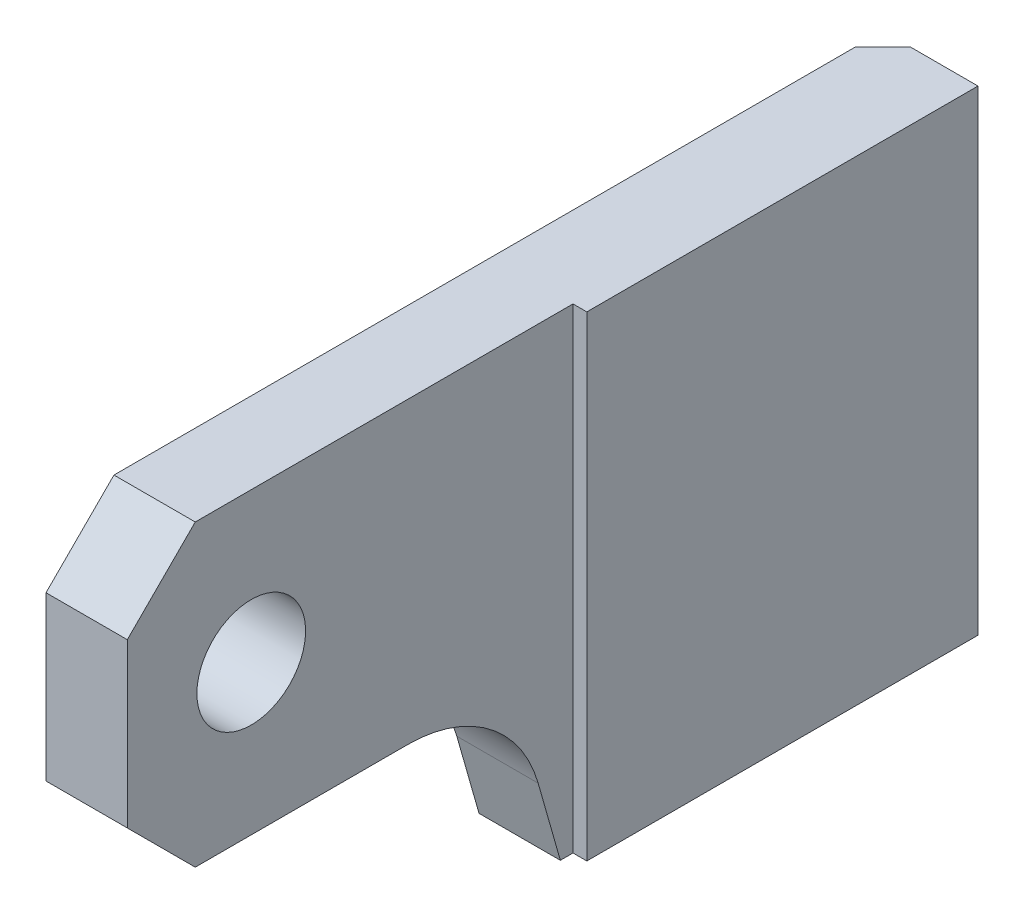
from build123d import *

# Parameters (mm, degrees)
EXTRUDE_1_DEPTH     = 7
FILLET_1_R          = 10
CHAMFER_1_SIZE      = 5
CHAMFER_2_SIZE      = 2
SKETCH_2_W          = 22.368466887
SKETCH_2_H          = 53.156625086
CUT_EXTRUDE_1_DEPTH = 100.184312104
SKETCH_3_R          = 4
CUT_EXTRUDE_2_DEPTH = 100.50128502


with BuildPart() as part:
    # Эскиз1 → Вытянуть1 (new body)
    with BuildSketch(Plane(origin=(0, 0, 0), x_dir=(0, 0, -1), z_dir=(1, 0, 0))):
        Polygon((62.822655934, -35.882923805), (59.120013374, -22.888409733), (30.956731402, -22.888409733), (30.956731402, -0.888409733), (92.539330922, -0.888409733), (92.539330922, -35.888409733), align=None)
    extrude(amount=-EXTRUDE_1_DEPTH)

    # Скругление1
    fillet_1_edges = [part.edges().sort_by_distance(p)[0] for p in [
        (-3.5, -22.888409733, -59.120013374),
    ]]
    fillet(fillet_1_edges, radius=FILLET_1_R)

    # Фаска1
    chamfer_1_edges = [part.edges().sort_by_distance(p)[0] for p in [
        (-3.5, -22.888409733, -30.956731402),
        (-3.5, -0.888409733, -30.956731402),
    ]]
    chamfer(chamfer_1_edges, length=CHAMFER_1_SIZE)

    # Фаска2
    chamfer_2_edges = [part.edges().sort_by_distance(p)[0] for p in [
        (-7, -18.388409733, -92.539330922),
    ]]
    chamfer(chamfer_2_edges, length=CHAMFER_2_SIZE)

    # Эскиз2 → Вырез-Вытянуть1 (cut, through all)
    with BuildSketch(Plane(origin=(0, -0.888409733, 0), x_dir=(-1, 0, 0), z_dir=(0, 1, 0))):
        with Locations((-10.167320296, -37.175286002)):
            Rectangle(SKETCH_2_W, SKETCH_2_H)
    extrude(amount=-CUT_EXTRUDE_1_DEPTH, mode=Mode.SUBTRACT)

    # Эскиз3 → Вырез-Вытянуть2 (cut, through all)
    with BuildSketch(Plane.ZY.offset(7)):
        with Locations((-40.076852625, -11.888409733)):
            Circle(SKETCH_3_R)
    extrude(amount=-CUT_EXTRUDE_2_DEPTH, mode=Mode.SUBTRACT)


solid = part.part
